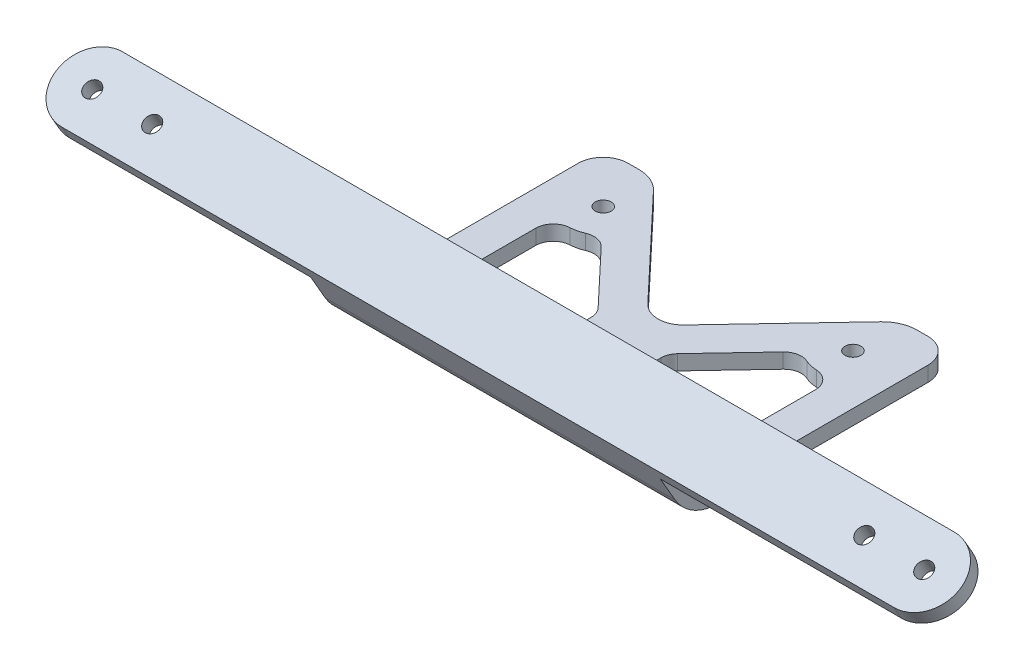
from build123d import *

# Parameters (mm, degrees)
SKETCH_1_W          = 70
SKETCH_1_H          = 50
EXTRUDE_1_DEPTH     = 3
EXTRUDE_2_DEPTH     = 70
SKETCH_3_R          = 1.6
EXTRUDE_3_DEPTH     = 3
EXTRUDE_4_REACH     = 139.875
SKETCH_4_W          = 70
SKETCH_4_H          = 5.267949192
FILLET_1_R          = 5
SKETCH_5_W          = 70
SKETCH_5_H          = 28.866025404
CUT_EXTRUDE_1_DEPTH = 138.47436204
SKETCH_6_W          = 70
SKETCH_6_H          = 3
CUT_EXTRUDE_2_DEPTH = 133.365261865
FILLET_2_R          = 5
SKETCH_7_R          = 1.6
CUT_EXTRUDE_3_DEPTH = 10
CUT_EXTRUDE_4_DEPTH = 10
CUT_EXTRUDE_5_DEPTH = 136.899592623
FILLET_4_R          = 10


with BuildPart() as part:
    # 草图1 → 凸台-拉伸1 (new body)
    with BuildSketch(Plane(origin=(0, 0, 0), x_dir=(1, 0, 0), z_dir=(0, 1, 0))):
        with Locations((35, 25)):
            Rectangle(SKETCH_1_W, SKETCH_1_H)
    extrude(amount=EXTRUDE_1_DEPTH)

    # 草图2 → 凸台-拉伸2 (add)
    with BuildSketch(Plane.ZY):
        Polygon((0, 15), (-6.062177826, 18.5), (-4.562177826, 21.098076211), (4, 16.154700538), (4, 15), (4, 0), (0, 0), align=None)
    extrude(amount=-EXTRUDE_2_DEPTH)

    # 草图3 → 凸台-拉伸3 (add)
    with BuildSketch(Plane(origin=(0, 13.848076211, 7.995190528), x_dir=(1, 0, 0), z_dir=(0, 0.86602540378444, 0.49999999999999784))):
        with BuildLine():
            Line((-48.265, 11.613248654), (-36.265, 11.613248654))
            Line((-36.265, 11.613248654), (106.265, 11.613248654))
            Line((106.265, 11.613248654), (118.265, 11.613248654))
            ThreePointArc((118.265, 11.613248654), (125.265, 4.613248654), (118.265, -2.386751346))
            Line((118.265, -2.386751346), (106.265, -2.386751346))
            Line((106.265, -2.386751346), (-36.265, -2.386751346))
            Line((-36.265, -2.386751346), (-48.265, -2.386751346))
            ThreePointArc((-48.265, -2.386751346), (-55.265, 4.613248654), (-48.265, 11.613248654))
        make_face()
        with Locations(Location((-36.265, 4.613248654, 0), (0, 0, 270))):
            Circle(SKETCH_3_R, mode=Mode.SUBTRACT)
        with Locations(Location((106.265, 4.613248654, 0), (0, 0, 270))):
            Circle(SKETCH_3_R, mode=Mode.SUBTRACT)
        with Locations(Location((-48.265, 4.613248654, 0), (0, 0, 270))):
            Circle(SKETCH_3_R, mode=Mode.SUBTRACT)
        with Locations(Location((118.265, 4.613248654, 0), (0, 0, 270))):
            Circle(SKETCH_3_R, mode=Mode.SUBTRACT)
    extrude(amount=-EXTRUDE_3_DEPTH)

    # 凸台-拉伸4: up to this face of the body (flat: up to its plane)
    extrude_4_end = Plane(part.part.faces().sort_by_distance((35, 6.345299462, 4))[0])
    # 草图4 → 凸台-拉伸4 (add, up to the picked face)
    with BuildSketch(Plane(origin=(0, 11.25, 6.495190528), x_dir=(1, 0, 0), z_dir=(0, -0.8660254037844396, -0.4999999999999982)), mode=Mode.PRIVATE) as extrude_4_sk1:
        with Locations((35, -0.24722325)):
            Rectangle(SKETCH_4_W, SKETCH_4_H)
    extrude_4_tool1 = split(extrude(extrude_4_sk1.sketch, amount=EXTRUDE_4_REACH, mode=Mode.PRIVATE), bisect_by=extrude_4_end, keep=Keep.BOTH, mode=Mode.PRIVATE)
    add(extrude_4_tool1.solids().sort_by(Axis((35, 11.373612, 6.281089), (0, -0.8660254037844396, -0.4999999999999982)))[0])

    # 圆角1
    fillet_1_edges = [part.edges().sort_by_distance(p)[0] for p in [
        (35, 3, 0),
    ]]
    fillet(fillet_1_edges, radius=FILLET_1_R)

    # 草图5 → 切除-拉伸1 (cut, through all)
    with BuildSketch(Plane(origin=(0, -1.193375673, 2.066987298), x_dir=(1, 0, 0), z_dir=(-1.4881366732147052e-15, -0.49999999999999784, 0.8660254037844398))):
        with Locations((35, -10.566987298)):
            Rectangle(SKETCH_5_W, SKETCH_5_H)
    extrude(amount=CUT_EXTRUDE_1_DEPTH, mode=Mode.SUBTRACT)

    # 草图6 → 切除-拉伸2 (cut, through all)
    with BuildSketch(Plane(origin=(0, 5.806624327, -10.057368355), x_dir=(-1, 0, 0), z_dir=(0, 0.49999999999999784, -0.8660254037844398))):
        with Locations((-35, 14.490381057)):
            Rectangle(SKETCH_6_W, SKETCH_6_H)
    extrude(amount=CUT_EXTRUDE_2_DEPTH, mode=Mode.SUBTRACT)

    # 圆角2
    fillet_2_edges = [part.edges().sort_by_distance(p)[0] for p in [
        (0, 1.5, -50),
        (70, 1.5, -50),
    ]]
    fillet(fillet_2_edges, radius=FILLET_2_R)

    # 草图7 → 切除-拉伸3 (cut)
    with BuildSketch(Plane(origin=(0, 3, 0), x_dir=(1, 0, 0), z_dir=(0, 1, 0))):
        with Locations(Location((10, 40, 0), (0, 0, 270))):
            Circle(SKETCH_7_R)
        with Locations(Location((60, 40, 0), (0, 0, 270))):
            Circle(SKETCH_7_R)
        with Locations(Location((35, 10, 0), (0, 0, 270))):
            Circle(SKETCH_7_R)
    extrude(amount=-CUT_EXTRUDE_3_DEPTH, mode=Mode.SUBTRACT)

    # 草图8 → 切除-拉伸4 (cut)
    with BuildSketch(Plane(origin=(0, 3, 0), x_dir=(1, 0, 0), z_dir=(0, 1, 0))):
        with BuildLine():
            ThreePointArc((31.364314075, 27.567539097), (33.020392023, 26.408578406), (35, 26))
            Line((35, 26), (35, 50))
            Line((35, 50), (7.167691896, 50))
            ThreePointArc((7.167691896, 50), (9.939143063, 49.427990232), (12.257652191, 47.805445265))
            Line((12.257652191, 47.805445265), (31.364314075, 27.567539097))
        make_face()
        with BuildLine():
            Line((35, 50), (35, 26))
            ThreePointArc((35, 26), (36.979607977, 26.408578406), (38.635685925, 27.567539097))
            Line((38.635685925, 27.567539097), (57.742347809, 47.805445265))
            ThreePointArc((57.742347809, 47.805445265), (60.060856937, 49.427990232), (62.832308104, 50))
            Line((62.832308104, 50), (35, 50))
        make_face()
    extrude(amount=-CUT_EXTRUDE_4_DEPTH, mode=Mode.SUBTRACT)

    # 草图9 → 切除-拉伸5 (cut, through all)
    with BuildSketch(Plane(origin=(0, 3, 0), x_dir=(1, 0, 0), z_dir=(0, 1, 0))):
        with BuildLine():
            Line((7, 29.511911518), (7, 12))
            ThreePointArc((7, 12), (8.025126266, 9.525126266), (10.5, 8.5))
            Line((10.5, 8.5), (24.5, 8.5))
            ThreePointArc((24.5, 8.5), (26.974873734, 9.525126266), (28, 12))
            Line((28, 12), (28, 19.543118511))
            ThreePointArc((28, 19.543118511), (27.752493698, 20.835900295), (27.044980148, 21.945841143))
            Line((27.044980148, 21.945841143), (16.795925867, 32.801709118))
            ThreePointArc((16.795925867, 32.801709118), (14.941700749, 33.830146274), (12.833963813, 33.599324324))
            ThreePointArc((12.833963813, 33.599324324), (11.611017181, 33.187906075), (10.333333333, 33.007941012))
            ThreePointArc((10.333333333, 33.007941012), (7.966885974, 31.927140976), (7, 29.511911518))
        make_face()
        with BuildLine():
            Line((42.955019852, 21.945841143), (53.204074133, 32.801709118))
            ThreePointArc((53.204074133, 32.801709118), (55.058299251, 33.830146274), (57.166036187, 33.599324324))
            ThreePointArc((57.166036187, 33.599324324), (58.388982819, 33.187906075), (59.666666667, 33.007941012))
            ThreePointArc((59.666666667, 33.007941012), (62.033114026, 31.927140976), (63, 29.511911518))
            Line((63, 29.511911518), (63, 12))
            ThreePointArc((63, 12), (61.974873734, 9.525126266), (59.5, 8.5))
            Line((59.5, 8.5), (45.5, 8.5))
            ThreePointArc((45.5, 8.5), (43.025126266, 9.525126266), (42, 12))
            Line((42, 12), (42, 19.543118511))
            ThreePointArc((42, 19.543118511), (42.247506302, 20.835900295), (42.955019852, 21.945841143))
        make_face()
    extrude(amount=-CUT_EXTRUDE_5_DEPTH, mode=Mode.SUBTRACT)

    # 圆角4
    fillet_4_edges = [part.edges().sort_by_distance(p)[0] for p in [
        (35, 0, 2.755983064),
    ]]
    fillet(fillet_4_edges, radius=FILLET_4_R)


solid = part.part
